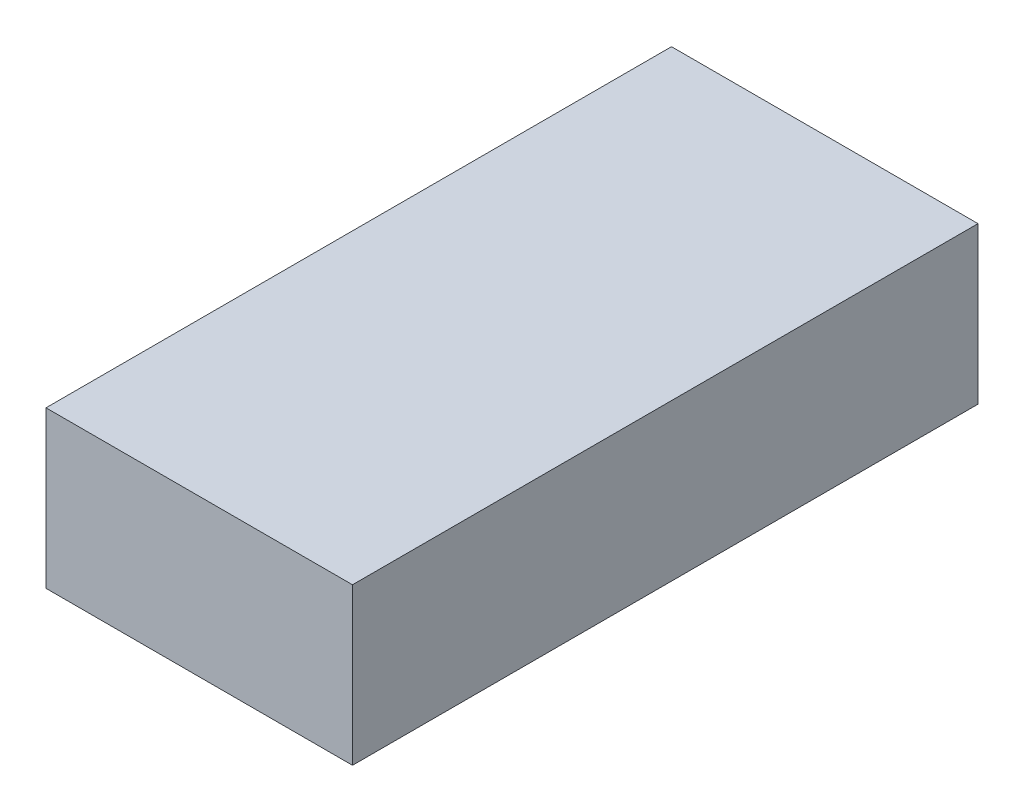
from build123d import *

# Parameters (mm, degrees)
SKETCH_1_W            = 98
SKETCH_1_H            = 50
EXTRUDE_305_DEPTH     = 100
HOLE_WIZARD_M41_D     = 3.3
HOLE_WIZARD_M41_DEPTH = 11.5
HOLE_WIZARD_M41_TIP   = 0.991420021


with BuildPart() as part:
    # Эскиз1 → Extrude 305 (new, symmetric)
    with BuildSketch(Plane.XY):
        Rectangle(SKETCH_1_W, SKETCH_1_H)
    extrude(amount=EXTRUDE_305_DEPTH, both=True)

    # Отверстие обработанное метчиком M41
    with Locations(Plane(origin=(0, -25, 0), x_dir=(-1, 0, 0), z_dir=(0, -1, 0))):
        with Locations((25, -75), (-25, -75), (-25, 75), (25, 75)):
            Hole(HOLE_WIZARD_M41_D / 2, depth=HOLE_WIZARD_M41_DEPTH)
            with Locations((0, 0, -(HOLE_WIZARD_M41_DEPTH + HOLE_WIZARD_M41_TIP / 2))):  # 118° drill point
                Cone(0, HOLE_WIZARD_M41_D / 2, HOLE_WIZARD_M41_TIP, mode=Mode.SUBTRACT)


solid = part.part
